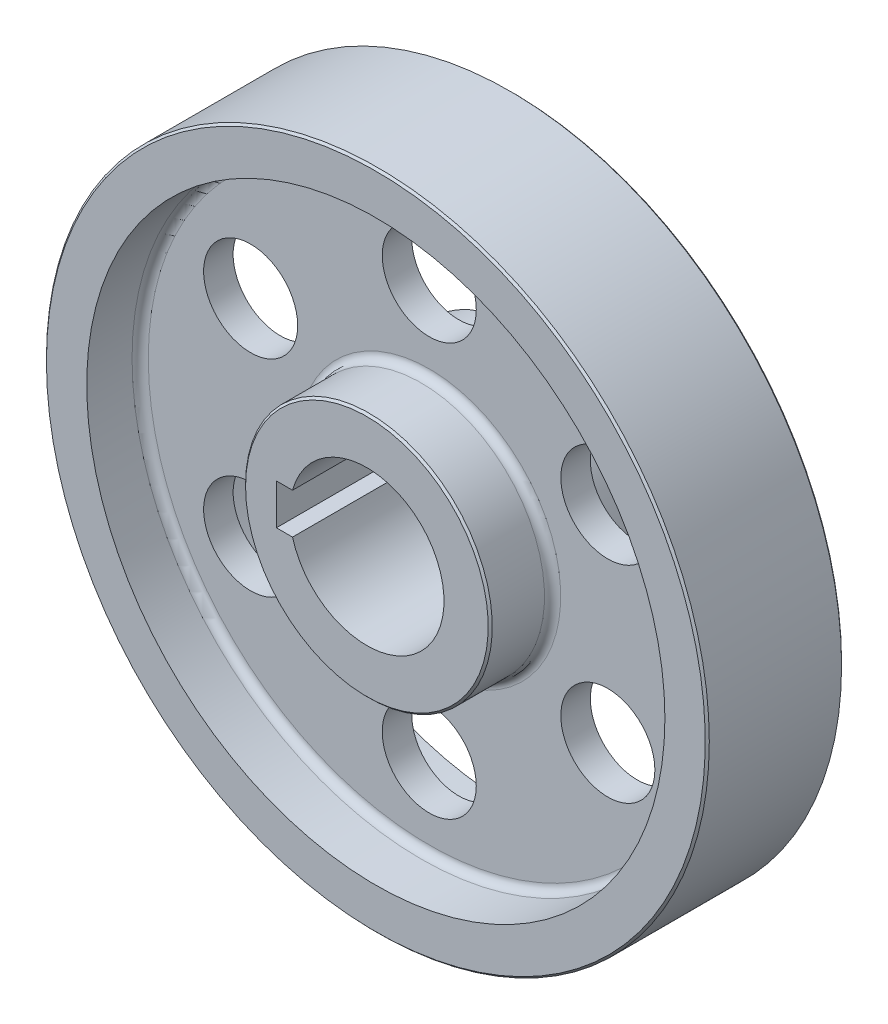
from build123d import *

# Parameters (mm, degrees)
CUT_EXTRUDE1_REACH = 119.708
SKETCH2_R          = 11.58920475
FILLET1_R          = 2
CUT_EXTRUDE3_REACH = 123.601
CHAMFER1_SIZE      = 0.5


with BuildPart() as part:
    # Sketch1 → Revolve1 (revolve)
    with BuildSketch(Plane(origin=(0, 0, 0), x_dir=(0, 0, -1), z_dir=(1, 0, 0)), mode=Mode.PRIVATE) as revolve1_sk:
        Polygon((-17.414092448, 19), (20.585907552, 19), (20.585907552, 30.4), (5.221286802, 30.4), (5.221286802, 71.23775235), (18.385907552, 71.23775235), (18.385907552, 81.6785385), (-15.214092448, 81.6785385), (-15.214092448, 71.23775235), (-2.049471698, 71.23775235), (-2.049471698, 30.4), (-17.414092448, 30.4), align=None)
    revolve(revolve1_sk.sketch.rotate(Axis((0, 0, 17.414092448), (0, 0, -1)), 90), axis=Axis((0, 0, 17.414092448), (0, 0, -1)))

    # Sketch2 → Cut-Extrude1 (cut, up to next)
    with BuildSketch(Plane.XY.offset(2.049471698), mode=Mode.PRIVATE) as cut_extrude1_sk1:
        with Locations((0, 50.8188762)):
            Circle(SKETCH2_R)
    cut_extrude1_tool1 = extrude(cut_extrude1_sk1.sketch, amount=-CUT_EXTRUDE1_REACH, mode=Mode.PRIVATE) & part.part
    # Sketch2 → Cut-Extrude1 (cut, up to next)
    with BuildSketch(Plane.XY.offset(2.049471698), mode=Mode.PRIVATE) as cut_extrude1_sk2:
        with Locations((44.010437781, 25.4094381)):
            Circle(SKETCH2_R)
    cut_extrude1_tool2 = extrude(cut_extrude1_sk2.sketch, amount=-CUT_EXTRUDE1_REACH, mode=Mode.PRIVATE) & part.part
    # Sketch2 → Cut-Extrude1 (cut, up to next)
    with BuildSketch(Plane.XY.offset(2.049471698), mode=Mode.PRIVATE) as cut_extrude1_sk3:
        with Locations((44.010437781, -25.4094381)):
            Circle(SKETCH2_R)
    cut_extrude1_tool3 = extrude(cut_extrude1_sk3.sketch, amount=-CUT_EXTRUDE1_REACH, mode=Mode.PRIVATE) & part.part
    # Sketch2 → Cut-Extrude1 (cut, up to next)
    with BuildSketch(Plane.XY.offset(2.049471698), mode=Mode.PRIVATE) as cut_extrude1_sk4:
        with Locations((0, -50.8188762)):
            Circle(SKETCH2_R)
    cut_extrude1_tool4 = extrude(cut_extrude1_sk4.sketch, amount=-CUT_EXTRUDE1_REACH, mode=Mode.PRIVATE) & part.part
    # Sketch2 → Cut-Extrude1 (cut, up to next)
    with BuildSketch(Plane.XY.offset(2.049471698), mode=Mode.PRIVATE) as cut_extrude1_sk5:
        with Locations((-44.010437781, -25.4094381)):
            Circle(SKETCH2_R)
    cut_extrude1_tool5 = extrude(cut_extrude1_sk5.sketch, amount=-CUT_EXTRUDE1_REACH, mode=Mode.PRIVATE) & part.part
    # Sketch2 → Cut-Extrude1 (cut, up to next)
    with BuildSketch(Plane.XY.offset(2.049471698), mode=Mode.PRIVATE) as cut_extrude1_sk6:
        with Locations((-44.010437781, 25.4094381)):
            Circle(SKETCH2_R)
    cut_extrude1_tool6 = extrude(cut_extrude1_sk6.sketch, amount=-CUT_EXTRUDE1_REACH, mode=Mode.PRIVATE) & part.part
    add(cut_extrude1_tool1.solids().sort_by_distance((0, 50.818876, 2.049472))[0], mode=Mode.SUBTRACT)
    add(cut_extrude1_tool2.solids().sort_by_distance((44.010438, 25.409438, 2.049472))[0], mode=Mode.SUBTRACT)
    add(cut_extrude1_tool3.solids().sort_by_distance((44.010438, -25.409438, 2.049472))[0], mode=Mode.SUBTRACT)
    add(cut_extrude1_tool4.solids().sort_by_distance((0, -50.818876, 2.049472))[0], mode=Mode.SUBTRACT)
    add(cut_extrude1_tool5.solids().sort_by_distance((-44.010438, -25.409438, 2.049472))[0], mode=Mode.SUBTRACT)
    add(cut_extrude1_tool6.solids().sort_by_distance((-44.010438, 25.409438, 2.049472))[0], mode=Mode.SUBTRACT)

    # Fillet1
    fillet1_edges = [part.edges().sort_by_distance(p)[0] for p in [
        (-71.23775235, 0, 2.049471698),
        (-71.23775235, 0, -5.221286802),
        (-30.4, 0, -5.221286802),
        (-30.4, 0, 2.049471698),
    ]]
    fillet(fillet1_edges, radius=FILLET1_R)

    # Sketch4 → Cut-Extrude3 (cut, up to next)
    with BuildSketch(Plane.XY.offset(17.414092448), mode=Mode.PRIVATE) as cut_extrude3_sk1:
        with BuildLine():
            Line((-22.3, 5), (-22.3, -5))
            Line((-22.3, -5), (-18.33030278, -5))
            ThreePointArc((-18.33030278, -5), (-19, 0), (-18.33030278, 5))
            Line((-18.33030278, 5), (-22.3, 5))
        make_face()
    cut_extrude3_tool1 = extrude(cut_extrude3_sk1.sketch, amount=-CUT_EXTRUDE3_REACH, mode=Mode.PRIVATE) & part.part
    add(cut_extrude3_tool1.solids().sort_by_distance((-20.533552, 0, 17.414092))[0], mode=Mode.SUBTRACT)

    # Chamfer1
    chamfer1_edges = [part.edges().sort_by_distance(p)[0] for p in [
        (-81.6785385, 0, 15.214092448),
        (-81.6785385, 0, -18.385907552),
        (-30.4, 0, -20.585907552),
        (-30.4, 0, 17.414092448),
    ]]
    chamfer(chamfer1_edges, length=CHAMFER1_SIZE)


solid = part.part
